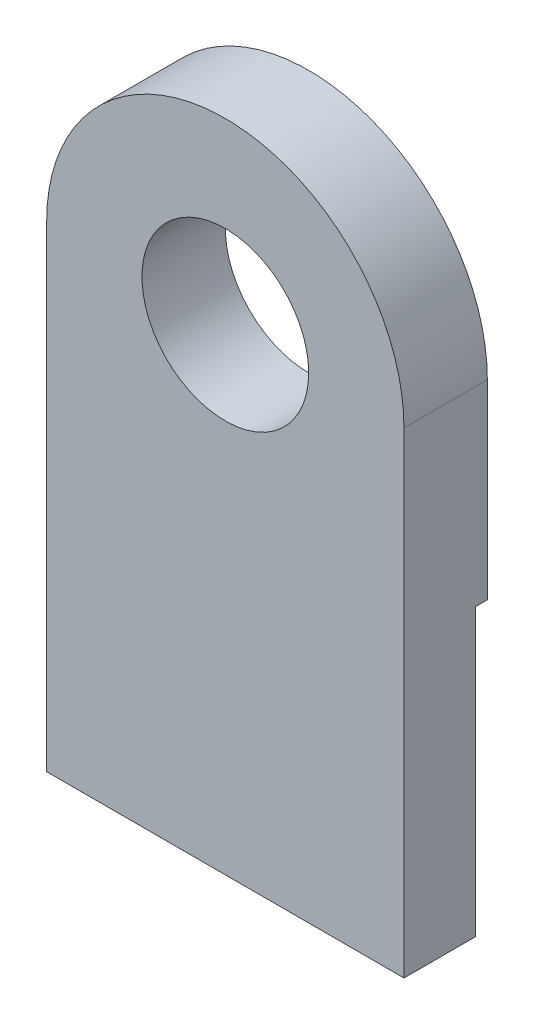
from build123d import *

# Parameters (mm, degrees)
SKETCH1_W           = 15
SKETCH1_H           = 12
BOSS_EXTRUDE1_DEPTH = 3
BOSS_EXTRUDE2_DEPTH = 3.5


with BuildPart() as part:
    # Sketch1 → Boss-Extrude1 (new body)
    with BuildSketch(Plane.XY):
        with Locations((7.5, 6)):
            Rectangle(SKETCH1_W, SKETCH1_H)
    extrude(amount=BOSS_EXTRUDE1_DEPTH)

    # Sketch2 → Boss-Extrude2 (add)
    with BuildSketch(Plane.XY.offset(3)):
        with BuildLine():
            Line((0, 20), (0, 12))
            Line((0, 12), (15, 12))
            Line((15, 12), (15, 20))
            ThreePointArc((15, 20), (7.5, 12.5), (0, 20))
        make_face()
        with BuildLine():
            ThreePointArc((15, 20), (7.5, 27.5), (0, 20))
            Line((0, 20), (4, 20))
            ThreePointArc((4, 20), (7.5, 23.5), (11, 20))
            Line((11, 20), (15, 20))
        make_face()
        with BuildLine():
            Line((4, 20), (0, 20))
            ThreePointArc((0, 20), (7.5, 12.5), (15, 20))
            Line((15, 20), (11, 20))
            ThreePointArc((11, 20), (7.5, 16.5), (4, 20))
        make_face()
    extrude(amount=-BOSS_EXTRUDE2_DEPTH)


solid = part.part
